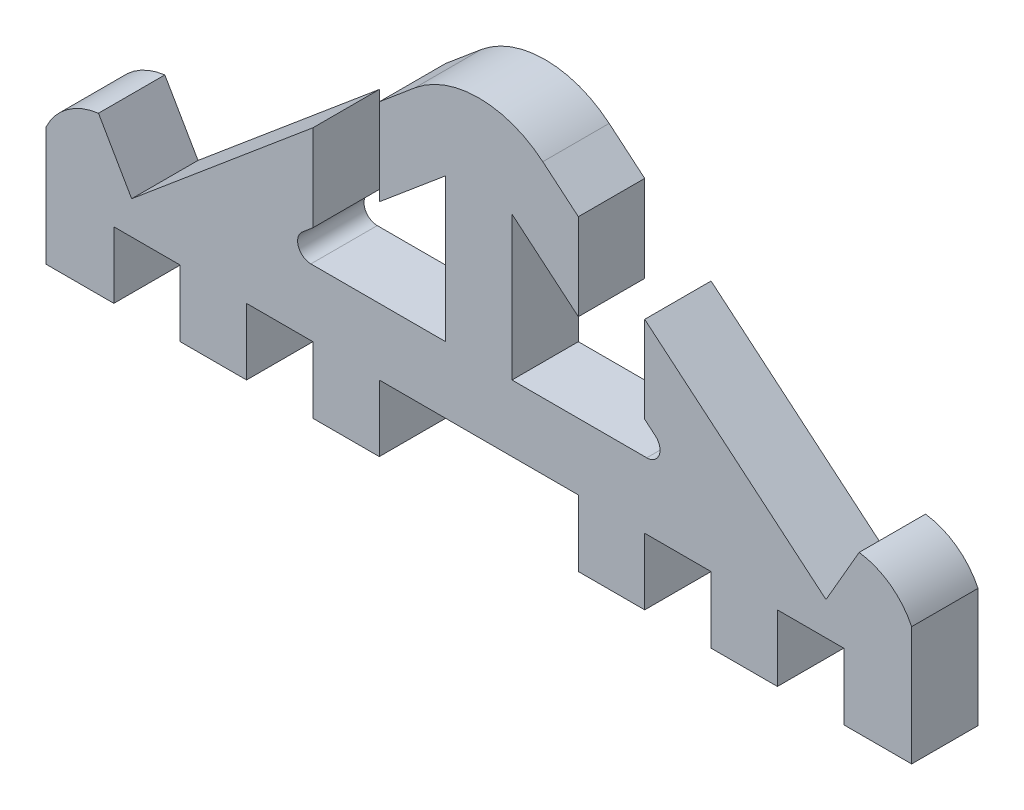
from build123d import *

# Parameters (mm, degrees)
BOSS_EXTRUDE1_DEPTH = 6.35


with BuildPart() as part:
    # Sketch1 → Boss-Extrude1 (new body)
    with BuildSketch(Plane.XY):
        with BuildLine():
            Line((-16.886131477, 10.741733319), (-15.875, 11.590173369))
            Line((-15.875, 11.590173369), (-15.875, 19.879509656))
            Line((-15.875, 19.879509656), (-33.221751492, 5.323856877))
            Line((-33.221751492, 5.323856877), (-36.396751492, 10.823118191))
            ThreePointArc((-36.396751492, 10.823118191), (-39.371085636, 9.639070453), (-41.418515119, 7.178041166))
            Line((-41.418515119, 7.178041166), (-41.418515119, -4.201143123))
            Line((-41.418515119, -4.201143123), (-34.925, -4.201143123))
            Line((-34.925, -4.201143123), (-34.925, 2.148856877))
            Line((-34.925, 2.148856877), (-28.575, 2.148856877))
            Line((-28.575, 2.148856877), (-28.575, -4.201143123))
            Line((-28.575, -4.201143123), (-22.225, -4.201143123))
            Line((-22.225, -4.201143123), (-22.225, 2.148856877))
            Line((-22.225, 2.148856877), (-15.875, 2.148856877))
            Line((-15.875, 2.148856877), (-15.875, -4.201143123))
            Line((-15.875, -4.201143123), (-9.525, -4.201143123))
            Line((-9.525, -4.201143123), (-9.525, 2.148856877))
            Line((-9.525, 2.148856877), (9.525, 2.148856877))
            Line((9.525, 2.148856877), (9.525, -4.201143123))
            Line((9.525, -4.201143123), (15.875, -4.201143123))
            Line((15.875, -4.201143123), (15.875, 2.148856877))
            Line((15.875, 2.148856877), (22.225, 2.148856877))
            Line((22.225, 2.148856877), (22.225, -4.201143123))
            Line((22.225, -4.201143123), (28.575, -4.201143123))
            Line((28.575, -4.201143123), (28.575, 2.148856877))
            Line((28.575, 2.148856877), (34.925, 2.148856877))
            Line((34.925, 2.148856877), (34.925, -4.201143123))
            Line((34.925, -4.201143123), (41.418515119, -4.201143123))
            Line((41.418515119, -4.201143123), (41.418515119, 7.178041166))
            ThreePointArc((41.418515119, 7.178041166), (39.371085636, 9.639070453), (36.396751492, 10.823118191))
            Line((36.396751492, 10.823118191), (33.221751492, 5.323856877))
            Line((33.221751492, 5.323856877), (15.875, 19.879509656))
            Line((15.875, 19.879509656), (15.875, 11.590173369))
            Line((15.875, 11.590173369), (16.886131477, 10.741733319))
            ThreePointArc((16.886131477, 10.741733319), (17.263200841, 9.334491295), (16.069791213, 8.498856877))
            Line((16.069791213, 8.498856877), (3.175, 8.498856877))
            Line((3.175, 8.498856877), (3.175, 22.246738685))
            Line((3.175, 22.246738685), (9.525, 16.918456027))
            Line((9.525, 16.918456027), (9.525, 25.207792314))
            Line((9.525, 25.207792314), (6.122551982, 28.062785191))
            ThreePointArc((6.122551982, 28.062785191), (0, 30.29121187), (-6.122551982, 28.062785191))
            Line((-6.122551982, 28.062785191), (-9.525, 25.207792314))
            Line((-9.525, 25.207792314), (-9.525, 16.918456027))
            Line((-9.525, 16.918456027), (-3.175, 22.246738685))
            Line((-3.175, 22.246738685), (-3.175, 8.498856877))
            Line((-3.175, 8.498856877), (-16.069791213, 8.498856877))
            ThreePointArc((-16.069791213, 8.498856877), (-17.263200841, 9.334491295), (-16.886131477, 10.741733319))
        make_face()
    extrude(amount=BOSS_EXTRUDE1_DEPTH)


solid = part.part
